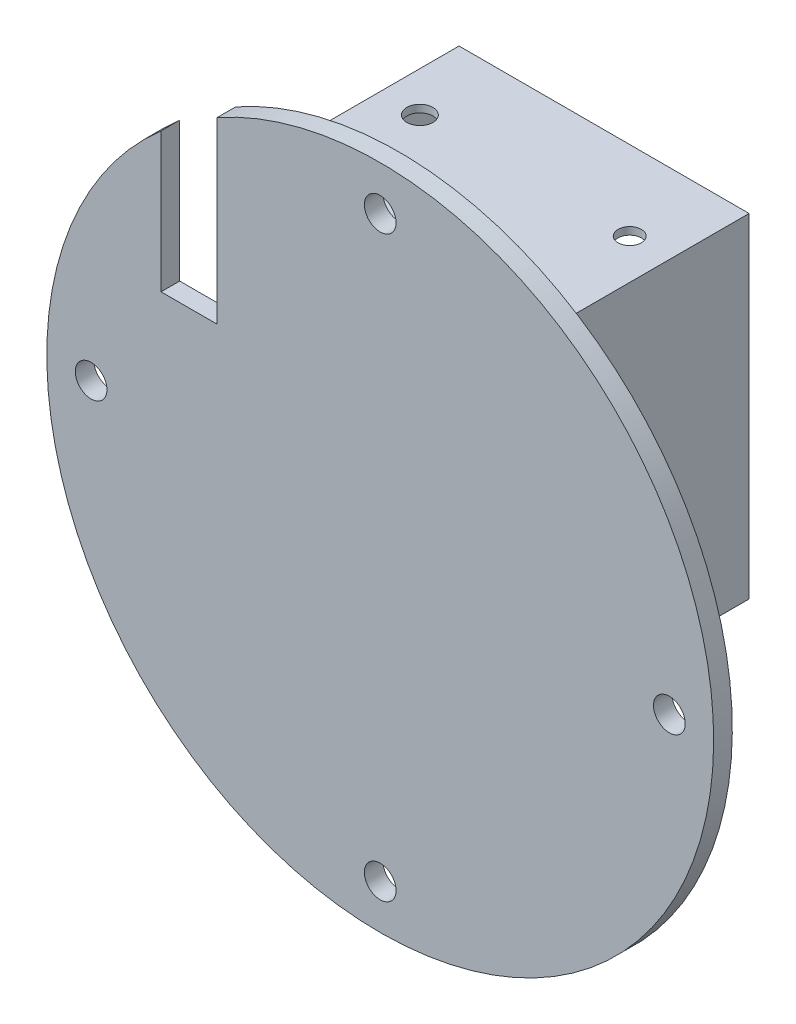
from build123d import *

# Parameters (mm, degrees)
SKETCH1_R           = 35.75
BOSS_EXTRUDE1_DEPTH = 2
BOSS_EXTRUDE2_DEPTH = 22
SKETCH3_W           = 29.5
SKETCH3_H           = 35
BOSS_EXTRUDE3_DEPTH = 10
SKETCH4_R           = 1.4
SKETCH4_R_2         = 1.25
CUT_EXTRUDE1_DEPTH  = 2
CUT_EXTRUDE2_DEPTH  = 10
SKETCH6_R           = 1.7
CUT_EXTRUDE3_DEPTH  = 34
CUT_EXTRUDE4_DEPTH  = 10


with BuildPart() as part:
    # Sketch1 → Boss-Extrude1 (new body)
    with BuildSketch(Plane.XY):
        Circle(SKETCH1_R)
    extrude(amount=BOSS_EXTRUDE1_DEPTH)

    # Sketch2 → Boss-Extrude2 (add)
    with BuildSketch(Plane(origin=(0, 0, 0), x_dir=(-1, 0, 0), z_dir=(0, 0, -1))):
        Polygon((14.75, 26), (-14.75, 26), (-14.75, -9), (-15.55, -9), (-15.55, 26.8), (15.55, 26.8), (15.55, -9), (14.75, -9), align=None)
    extrude(amount=BOSS_EXTRUDE2_DEPTH)

    # Sketch3 → Boss-Extrude3 (add)
    with BuildSketch(Plane(origin=(0, 0, 0), x_dir=(-1, 0, 0), z_dir=(0, 0, -1))):
        with Locations((0, 8.5)):
            Rectangle(SKETCH3_W, SKETCH3_H)
    extrude(amount=BOSS_EXTRUDE3_DEPTH)

    # Sketch4 → Cut-Extrude1 (cut)
    with BuildSketch(Plane.XZ.offset(-26)):
        with Locations((-11.25, -13.5)):
            Circle(SKETCH4_R)
        with Locations((11.25, -13.5)):
            Circle(SKETCH4_R_2)
    extrude(amount=-CUT_EXTRUDE1_DEPTH, mode=Mode.SUBTRACT)

    # Sketch5 → Cut-Extrude2 (cut)
    with BuildSketch(Plane.XY.offset(2)):
        Polygon((-23.5, 12), (-17.5, 12), (-17.5, 22), (-23.5, 22.131751807), align=None)
    extrude(amount=-CUT_EXTRUDE2_DEPTH, mode=Mode.SUBTRACT)

    # Sketch6 → Cut-Extrude3 (cut)
    with BuildSketch(Plane.XY.offset(2)):
        with Locations((-31, 0)):
            Circle(SKETCH6_R)
        with Locations((0, 31)):
            Circle(SKETCH6_R)
        with Locations((31, 0)):
            Circle(SKETCH6_R)
        with Locations((0, -31)):
            Circle(SKETCH6_R)
    extrude(amount=-CUT_EXTRUDE3_DEPTH, mode=Mode.SUBTRACT)

    # Sketch7 → Cut-Extrude4 (cut)
    with BuildSketch(Plane.XY.offset(2)):
        Polygon((-17.5, 12), (-23.5, 12), (-23.5, 35.926459787), (-17.5, 35.79470798), align=None)
    extrude(amount=-CUT_EXTRUDE4_DEPTH, mode=Mode.SUBTRACT)


solid = part.part
